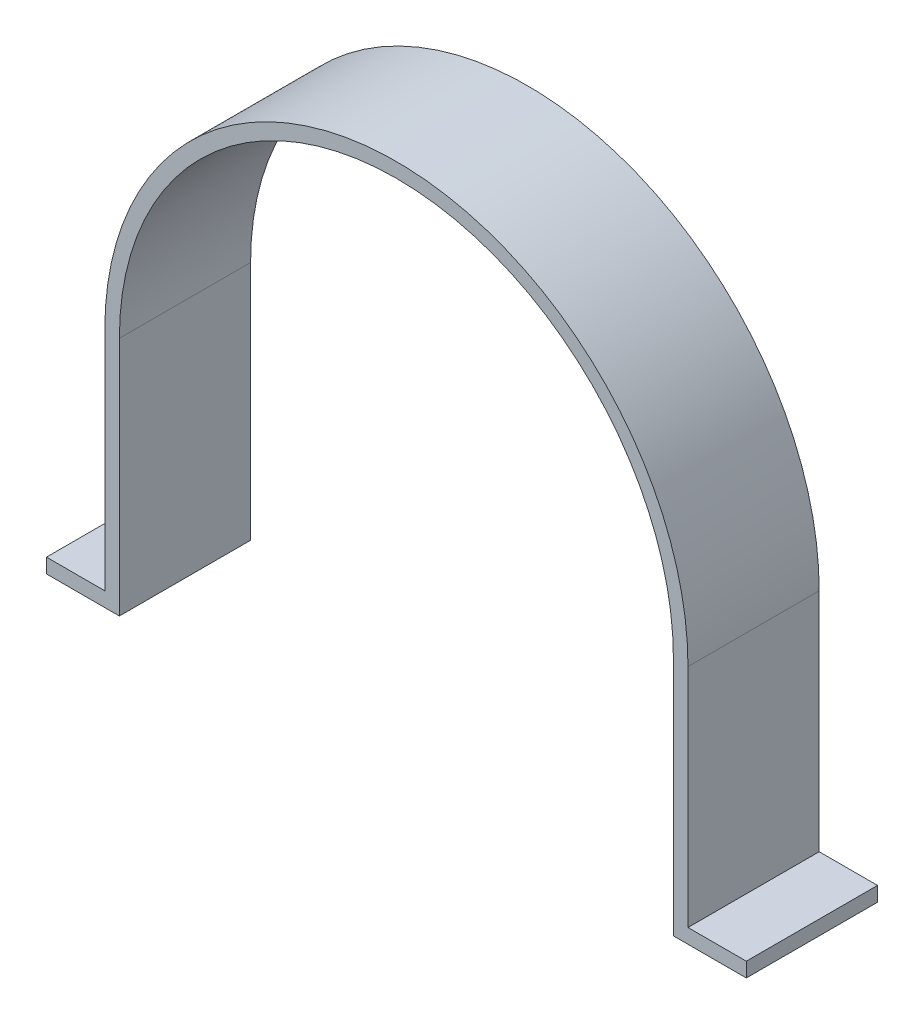
from build123d import *

# Parameters (mm, degrees)
BAND_CROSS_SECTION_DEPTH = 9


with BuildPart() as part:
    # Band cross-section profile → Band cross-section (new body)
    with BuildSketch(Plane.XY):
        with BuildLine():
            Line((19, 28.5), (19, 12))
            Line((19, 12), (24, 12))
            Line((24, 12), (24, 13))
            Line((24, 13), (20, 13))
            Line((20, 13), (20, 28.5))
            ThreePointArc((20, 28.5), (0, 48.5), (-20, 28.5))
            Line((-20, 28.5), (-20, 13))
            Line((-20, 13), (-24, 13))
            Line((-24, 13), (-24, 12))
            Line((-24, 12), (-19, 12))
            Line((-19, 12), (-19, 28.5))
            ThreePointArc((-19, 28.5), (0, 47.5), (19, 28.5))
        make_face()
    extrude(amount=BAND_CROSS_SECTION_DEPTH)


solid = part.part
